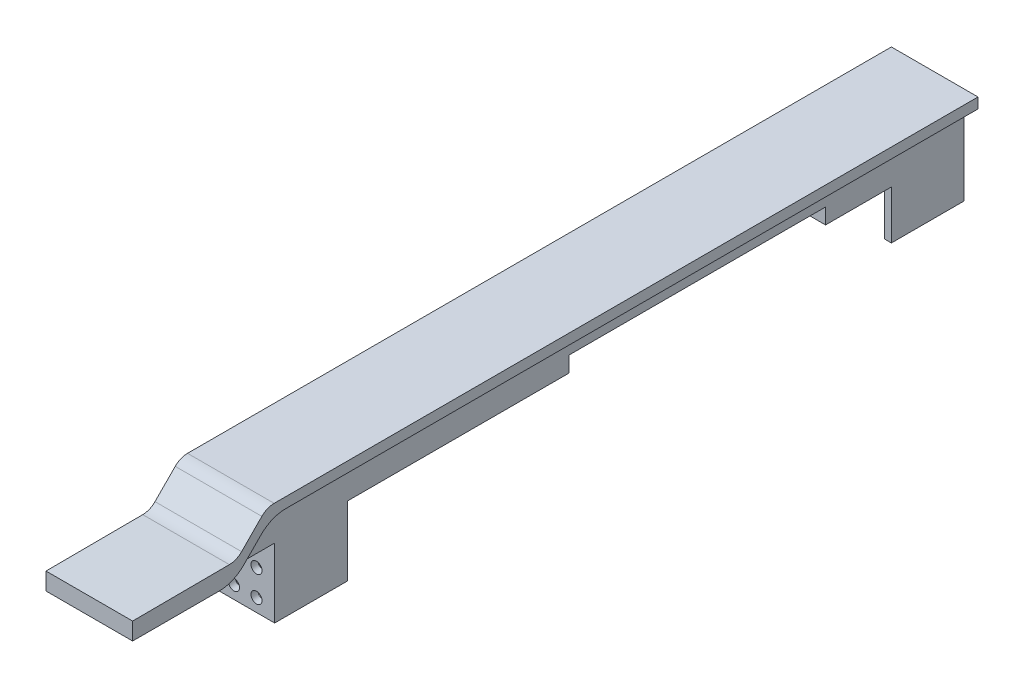
from build123d import *

# Parameters (mm, degrees)
BOSS_EXTRUDE1_DEPTH = 25
CUT_EXTRUDE2_DEPTH  = 4
FILLET6_R           = 10
FILLET7_R           = 5
BOSS_EXTRUDE2_DEPTH = 20
SKETCH8_R           = 1.6
CUT_EXTRUDE3_DEPTH  = 2
BOSS_EXTRUDE3_DEPTH = 14
SKETCH11_R          = 1.6
CUT_EXTRUDE4_DEPTH  = 2


with BuildPart() as part:
    # Sketch1 → Boss-Extrude1 (new body)
    with BuildSketch(Plane(origin=(0, 0, 0), x_dir=(0, 0, -1), z_dir=(1, 0, 0))):
        Polygon((0, 0), (-130, 0), (-130, 5), (-100.000366453, 5.148280317), (-91.235719846, 14), (114, 14), (114, 0), (74, 0), (74, 4.5), (0, 4.5), align=None)
    extrude(amount=BOSS_EXTRUDE1_DEPTH)

    # Sketch6 → Cut-Extrude2 (cut)
    with BuildSketch(Plane(origin=(25, 0, 0), x_dir=(0, 0, -1), z_dir=(1, 0, 0))):
        Polygon((-100.876178749, 0), (114, 0), (114, 11), (-89.984384146, 11), align=None)
    cut_extrude2 = extrude(amount=-CUT_EXTRUDE2_DEPTH, mode=Mode.SUBTRACT)

    # Mirror3: Cut-Extrude2 across plane
    add(cut_extrude2.mirror(Plane(origin=(12.5, 0, 0), x_dir=(0, 0, 1), z_dir=(1, 0, 0))), mode=Mode.SUBTRACT)

    # Fillet6
    fillet6_edges = [part.edges().sort_by_distance(p)[0] for p in [
        (23, 0, 100.876178749),
        (23, 11, 89.984384146),
        (2, 0, 100.876178749),
        (2, 11, 89.984384146),
    ]]
    fillet(fillet6_edges, radius=FILLET6_R)

    # Fillet7
    fillet7_edges = [part.edges().sort_by_distance(p)[0] for p in [
        (12.5, 5.148280317, 100.000366453),
        (12.5, 14, 91.235719846),
    ]]
    fillet(fillet7_edges, radius=FILLET7_R)

    # Sketch7 → Boss-Extrude2 (add)
    with BuildSketch(Plane.XZ):
        Polygon((21, 85), (4, 85), (4, 64), (6, 64), (6, 83), (19, 83), (19, 64), (21, 64), align=None)
    extrude(amount=BOSS_EXTRUDE2_DEPTH)

    # Sketch8 → Cut-Extrude3 (cut)
    with BuildSketch(Plane.XY.offset(85)):
        with Locations((15.75, -16.25)):
            Circle(SKETCH8_R)
        with Locations((9.25, -16.25)):
            Circle(SKETCH8_R)
        with Locations((9.25, -8.75)):
            Circle(SKETCH8_R)
        with Locations((15.75, -8.75)):
            Circle(SKETCH8_R)
    extrude(amount=-CUT_EXTRUDE3_DEPTH, mode=Mode.SUBTRACT)

    # Sketch9 → Boss-Extrude3 (add)
    with BuildSketch(Plane.XZ):
        Polygon((4, -114), (21, -114), (21, -93), (19, -93), (19, -112), (6, -112), (6, -93), (4, -93), align=None)
    extrude(amount=BOSS_EXTRUDE3_DEPTH)

    # Sketch11 → Cut-Extrude4 (cut)
    with BuildSketch(Plane(origin=(0, 0, -114), x_dir=(-1, 0, 0), z_dir=(0, 0, -1))):
        with Locations((-9.25, -10.25)):
            Circle(SKETCH11_R)
        with Locations((-15.75, -10.25)):
            Circle(SKETCH11_R)
    extrude(amount=-CUT_EXTRUDE4_DEPTH, mode=Mode.SUBTRACT)


solid = part.part
